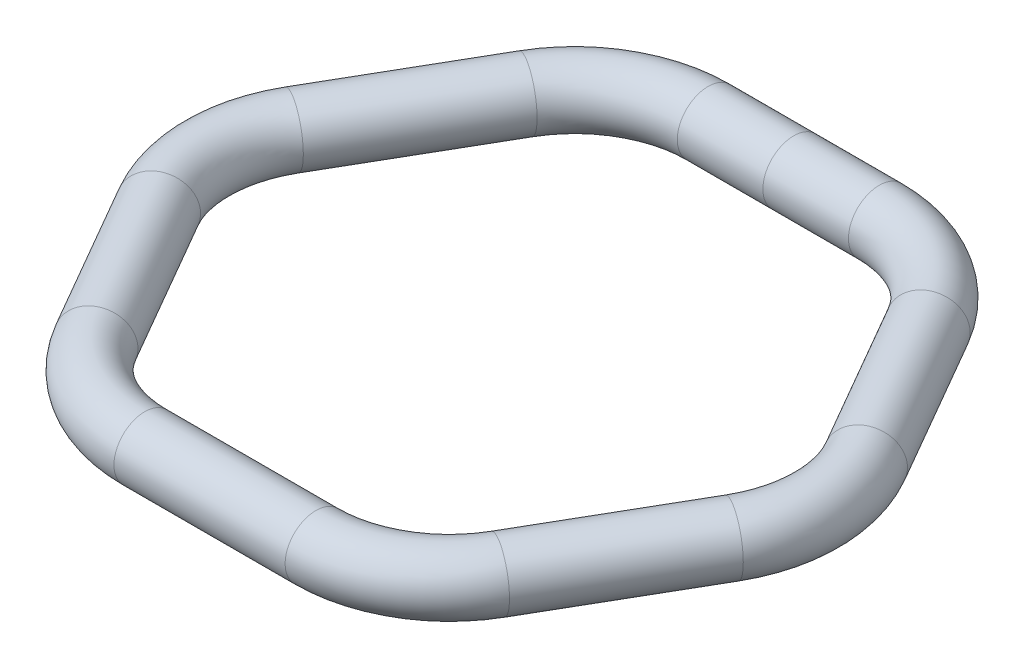
from build123d import *

# Parameters (mm, degrees)
SKETCH2_R = 7.5


with BuildPart() as part:
    # Sweep1: sweep along a path in Sketch1
    with BuildLine(Plane(origin=(0, 0, 0), x_dir=(1, 0, 0), z_dir=(0, 1, 0))) as sweep1_path:
        Line((63.33532453, 12.5), (42.492979812, 48.6))
        ThreePointArc((42.492979812, 48.6), (33.342344718, 57.750635095), (20.842344718, 61.1))
        Line((20.842344718, 61.1), (-20.842344718, 61.1))
        ThreePointArc((-20.842344718, 61.1), (-33.342344718, 57.750635095), (-42.492979812, 48.6))
        Line((-42.492979812, 48.6), (-63.33532453, 12.5))
        ThreePointArc((-63.33532453, 12.5), (-66.684689435, 0), (-63.33532453, -12.5))
        Line((-63.33532453, -12.5), (-42.492979812, -48.6))
        ThreePointArc((-42.492979812, -48.6), (-33.342344718, -57.750635095), (-20.842344718, -61.1))
        Line((-20.842344718, -61.1), (20.842344718, -61.1))
        ThreePointArc((20.842344718, -61.1), (33.342344718, -57.750635095), (42.492979812, -48.6))
        Line((42.492979812, -48.6), (63.33532453, -12.5))
        ThreePointArc((63.33532453, -12.5), (66.684689435, 0), (63.33532453, 12.5))
    # Sketch2 → Sweep1 (sweep)
    with BuildSketch(Plane(origin=(0, 0, 0), x_dir=(0, 0, -1), z_dir=(1, 0, 0))):
        with Locations((68.6, 0)):
            Circle(SKETCH2_R)
    sweep(path=sweep1_path.line)


solid = part.part
